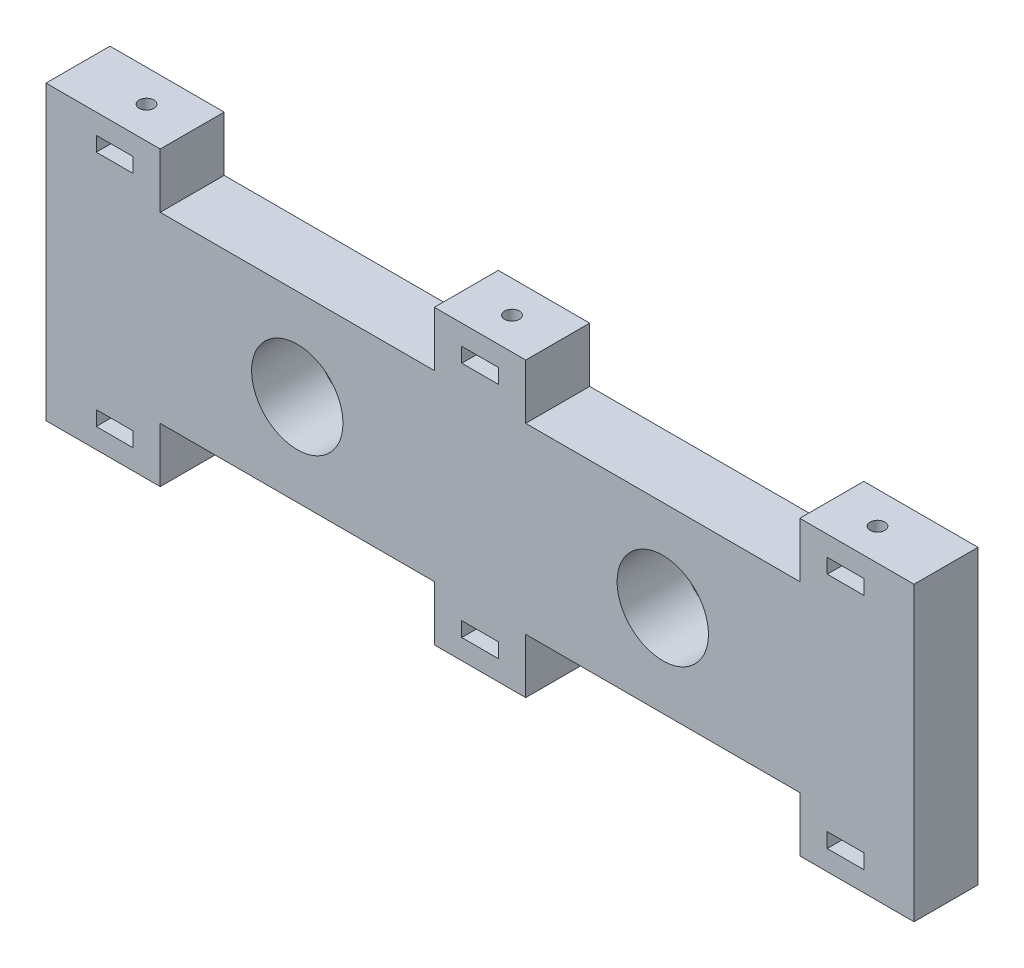
from build123d import *

# Parameters (mm, degrees)
SKETCH_1_R          = 5
EXTRUDE_1_DEPTH     = 7
M2X0_4_1_D          = 1.6
CUT_EXTRUDE_1_DEPTH = 0.8
CUT_EXTRUDE_2_DEPTH = 0.8


with BuildPart() as part:
    # 草图1 → 凸台-拉伸1 (new body)
    with BuildSketch(Plane.XY):
        Polygon((-15, 10), (-15, 16), (-27.5, 16), (-27.5, -16), (-15, -16), (-15, -10), (15, -10), (15, -16), (25, -16), (25, -10), (55, -10), (55, -16), (67.5, -16), (67.5, 16), (55, 16), (55, 10), (25, 10), (25, 16), (15, 16), (15, 10), align=None)
        Circle(SKETCH_1_R, mode=Mode.SUBTRACT)
        with Locations(Location((40, 0, 0), (0, 0, 180))):
            Circle(SKETCH_1_R, mode=Mode.SUBTRACT)
    extrude(amount=EXTRUDE_1_DEPTH)

    # M2x0.4 螺纹孔1 (through all)
    with Locations(Plane(origin=(-20, 16, 3.5), x_dir=(0, 0, 1), z_dir=(0, 1, 0))):
        with Locations((0, 0), (0, 40), (0, 80)):
            Hole(M2X0_4_1_D / 2)

    # 草图4 → 切除-拉伸1 (cut, symmetric)
    with BuildSketch(Plane(origin=(0, 13, 0), x_dir=(1, 0, 0), z_dir=(0, 1, 0))):
        Polygon((-22, -4.654700538), (-22, -7), (-18, -7), (-18, -4.654700538), (-18, -2.345299462), (-20, -1.190598923), (-22, -2.345299462), align=None)
        Polygon((18, -4.654700538), (18, -7), (22, -7), (22, -4.654700538), (22, -2.345299462), (20, -1.190598923), (18, -2.345299462), align=None)
        Polygon((58, -4.654700538), (58, -7), (62, -7), (62, -4.654700538), (62, -2.345299462), (60, -1.190598923), (58, -2.345299462), align=None)
    extrude(amount=CUT_EXTRUDE_1_DEPTH, both=True, mode=Mode.SUBTRACT)

    # 草图5 → 切除-拉伸2 (cut, symmetric)
    with BuildSketch(Plane(origin=(0, -13, 0), x_dir=(-1, 0, 0), z_dir=(0, -1, 0))):
        Polygon((-20, -1.190598923), (-22, -2.345299462), (-22, -4.654700538), (-22, -7), (-18, -7), (-18, -4.654700538), (-18, -2.345299462), align=None)
        Polygon((-60, -1.190598923), (-62, -2.345299462), (-62, -4.654700538), (-62, -7), (-58, -7), (-58, -4.654700538), (-58, -2.345299462), align=None)
        Polygon((20, -1.190598923), (18, -2.345299462), (18, -4.654700538), (18, -7), (22, -7), (22, -4.654700538), (22, -2.345299462), align=None)
    extrude(amount=CUT_EXTRUDE_2_DEPTH, both=True, mode=Mode.SUBTRACT)


solid = part.part
